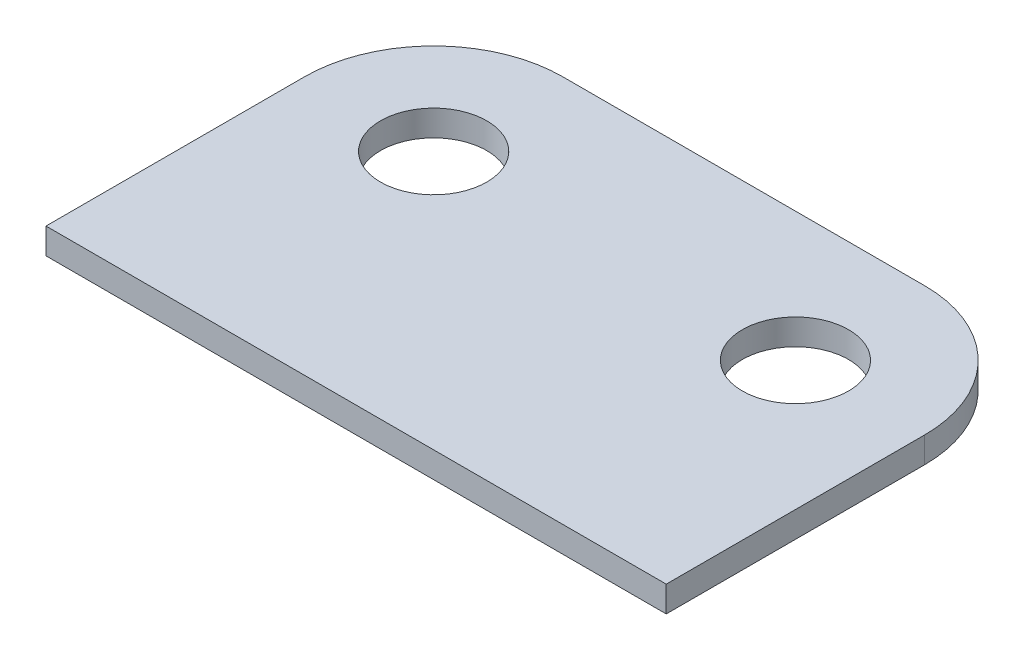
from build123d import *

# Parameters (mm, degrees)
SKETCH1_R           = 3.2639
BOSS_EXTRUDE1_DEPTH = 1.5875


with BuildPart() as part:
    # Sketch1 → Boss-Extrude1 (new body)
    with BuildSketch(Plane(origin=(0, 0, 0), x_dir=(1, 0, 0), z_dir=(0, 1, 0))):
        with BuildLine():
            Line((-19.05, 0), (19.05, 0))
            Line((19.05, 0), (19.05, 15.875))
            ThreePointArc((19.05, 15.875), (16.725160076, 21.487660076), (11.1125, 23.8125))
            Line((11.1125, 23.8125), (-11.1125, 23.8125))
            ThreePointArc((-11.1125, 23.8125), (-16.725160076, 21.487660076), (-19.05, 15.875))
            Line((-19.05, 15.875), (-19.05, 0))
        make_face()
        with Locations(Location((-11.1125, 15.875, 0), (0, 0, 270))):
            Circle(SKETCH1_R, mode=Mode.SUBTRACT)
        with Locations(Location((11.1125, 15.875, 0), (0, 0, 270))):
            Circle(SKETCH1_R, mode=Mode.SUBTRACT)
    extrude(amount=BOSS_EXTRUDE1_DEPTH)


solid = part.part
